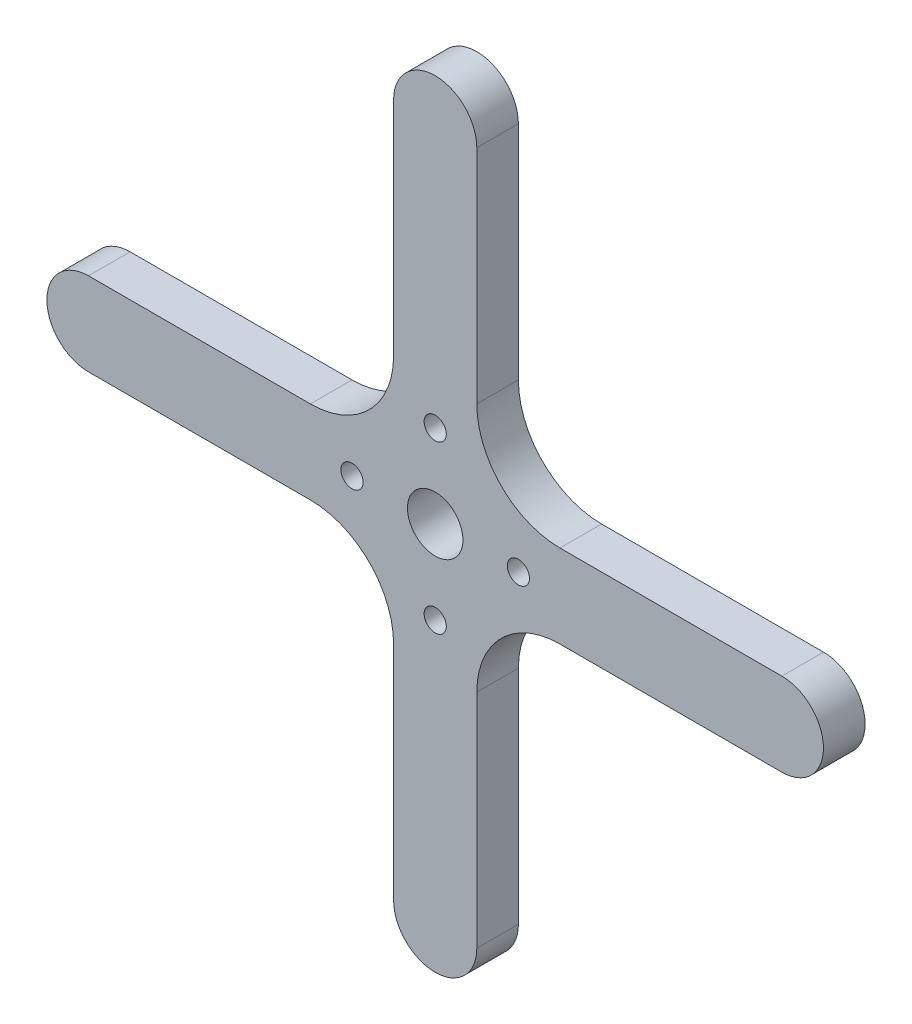
from build123d import *

# Parameters (mm, degrees)
SKETCH1_R           = 0.8
BOSS_EXTRUDE1_DEPTH = 3
FILLET1_R           = 6
SKETCH2_R           = 2
CUT_EXTRUDE1_DEPTH  = 3


with BuildPart() as part:
    # Sketch1 → Boss-Extrude1 (new body)
    # profile 1 of 2: a face of its own
    with BuildSketch(Plane.XY):
        with BuildLine():
            Line((25, -3), (-25, -3))
            ThreePointArc((-25, -3), (-28, 0), (-25, 3))
            Line((-25, 3), (25, 3))
            ThreePointArc((25, 3), (28, 0), (25, -3))
        make_face()
        with Locations((-6, 0)):
            Circle(SKETCH1_R, mode=Mode.SUBTRACT)
        with Locations((6, 0)):
            Circle(SKETCH1_R, mode=Mode.SUBTRACT)
    # profile 2 of 2: a face of its own
    with BuildSketch(Plane.XY):
        with BuildLine():
            Line((-3, -25), (-3, 25))
            ThreePointArc((-3, 25), (0, 28), (3, 25))
            Line((3, 25), (3, -25))
            ThreePointArc((3, -25), (0, -28), (-3, -25))
        make_face()
        with Locations((0, 6)):
            Circle(SKETCH1_R, mode=Mode.SUBTRACT)
        with Locations((0, -6)):
            Circle(SKETCH1_R, mode=Mode.SUBTRACT)
    extrude(amount=BOSS_EXTRUDE1_DEPTH)

    # Fillet1
    fillet1_edges = [part.edges().sort_by_distance(p)[0] for p in [
        (3, -3, 1.5),
        (-3, -3, 1.5),
        (-3, 3, 1.5),
        (3, 3, 1.5),
    ]]
    fillet(fillet1_edges, radius=FILLET1_R)

    # Sketch2 → Cut-Extrude1 (cut)
    with BuildSketch(Plane.XY.offset(3)):
        Circle(SKETCH2_R)
    extrude(amount=-CUT_EXTRUDE1_DEPTH, mode=Mode.SUBTRACT)


solid = part.part
